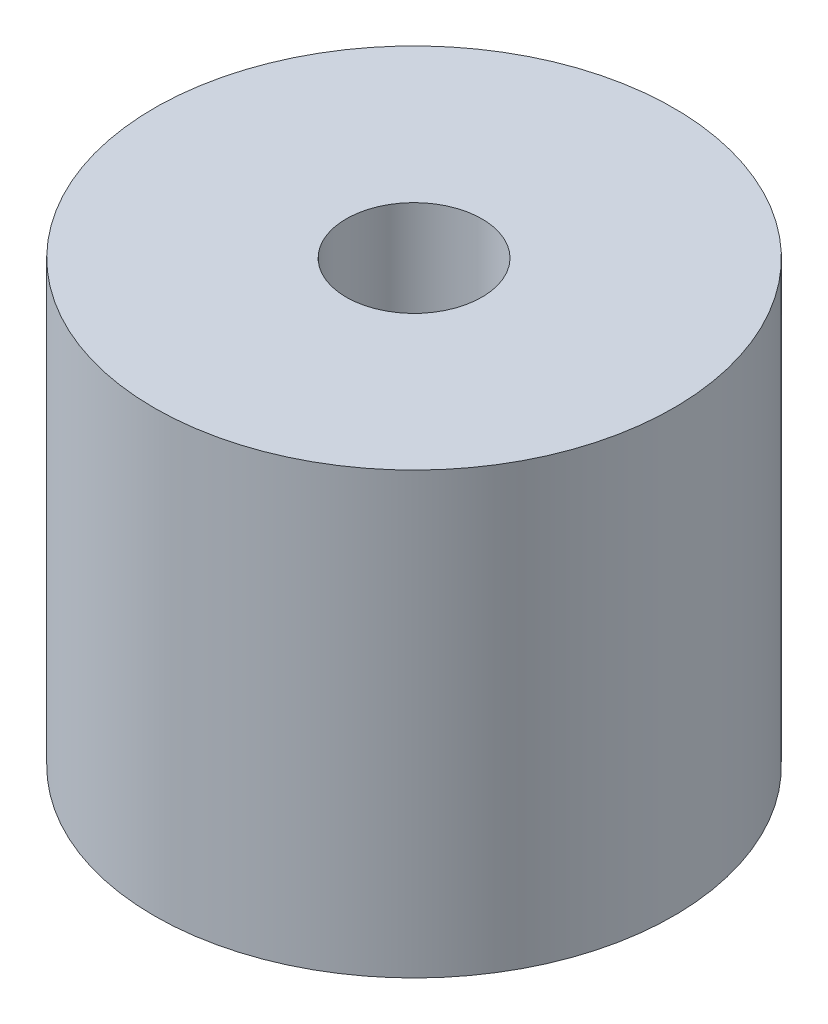
from build123d import *

# Parameters (mm, degrees)
SKETCH1_R              = 9.525
BOSS_EXTRUDE1_DEPTH    = 16.129
F_10_CLEARANCE_HOLE1_D = 4.9784


with BuildPart() as part:
    # Sketch1 → Boss-Extrude1 (new body)
    with BuildSketch(Plane(origin=(0, 0, 0), x_dir=(1, 0, 0), z_dir=(0, 1, 0))):
        with Locations(Location((0, 0, 0), (0, 0, 270))):
            Circle(SKETCH1_R)
    extrude(amount=BOSS_EXTRUDE1_DEPTH)

    # #10 Clearance Hole1 (through all)
    with Locations(Plane(origin=(0, 16.129, 0), x_dir=(1, 0, 0), z_dir=(0, 1, 0))):
        with Locations((0, 0)):
            Hole(F_10_CLEARANCE_HOLE1_D / 2)


solid = part.part
